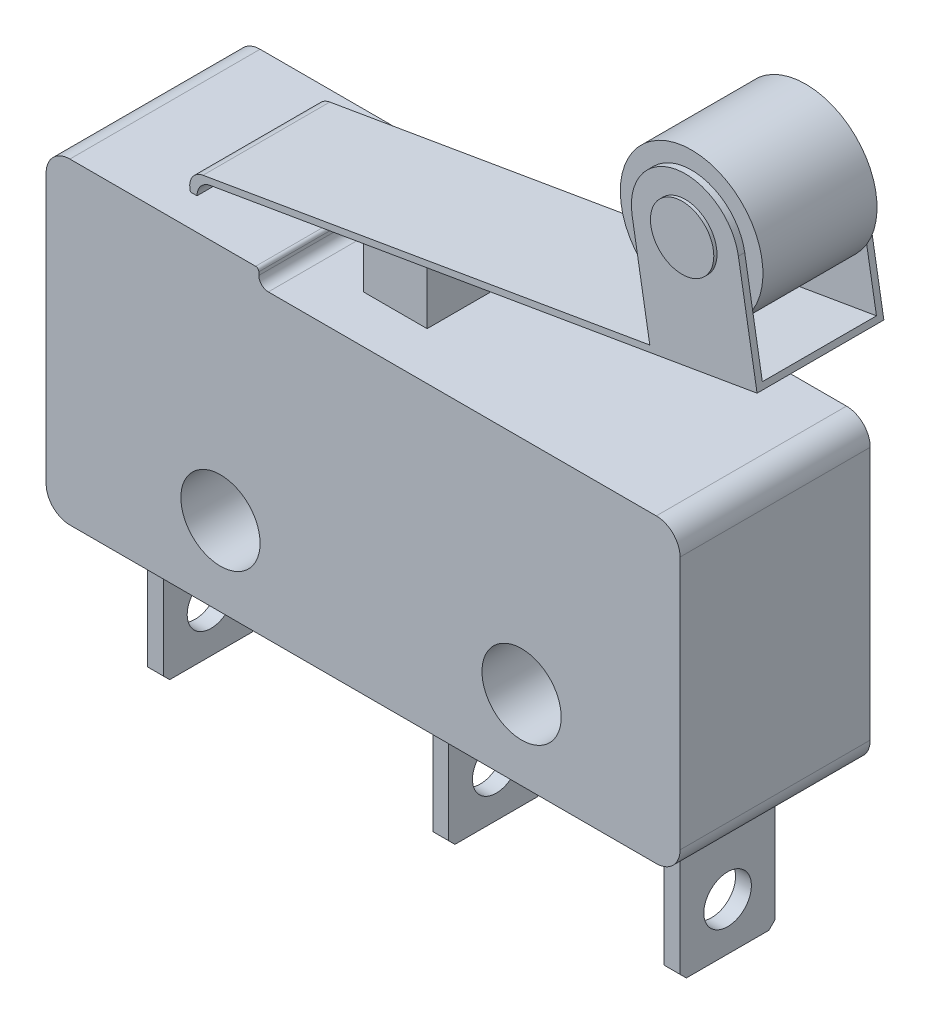
from build123d import *

# Parameters (mm, degrees)
CROQUIS1_R              = 1.25
SALIENTE_EXTRUIR3_DEPTH = 3
CROQUIS7_W              = 0.5
CROQUIS7_H              = 4.35
SALIENTE_EXTRUIR4_DEPTH = 1.5
CROQUIS8_R              = 0.75
CORTAR_EXTRUIR1_DEPTH   = 21.944510021
SALIENTE_EXTRUIR5_DEPTH = 1.5
CROQUIS10_R             = 0.5
SALIENTE_EXTRUIR6_DEPTH = 2
CORTAR_EXTRUIR2_REACH   = 27.447
CROQUIS11_W             = 3.6
CROQUIS11_H             = 5.5
CROQUIS12_R             = 2.25
SALIENTE_EXTRUIR8_DEPTH = 3.6
CROQUIS13_R             = 1
SALIENTE_EXTRUIR9_DEPTH = 2.1


with BuildPart() as part:
    # Croquis1 → Saliente-Extruir3 (new, symmetric)
    with BuildSketch(Plane.XY):
        with BuildLine():
            Line((-9.25, 5), (-3.39, 5))
            ThreePointArc((-3.39, 5), (-3.319289322, 4.970710678), (-3.29, 4.9))
            Line((-3.29, 4.9), (-3.29, 4.8))
            ThreePointArc((-3.29, 4.8), (-3.202132034, 4.587867966), (-2.99, 4.5))
            Line((-2.99, 4.5), (9.25, 4.5))
            ThreePointArc((9.25, 4.5), (9.780330086, 4.280330086), (10, 3.75))
            Line((10, 3.75), (10, -4.25))
            ThreePointArc((10, -4.25), (9.780330086, -4.780330086), (9.25, -5))
            Line((9.25, -5), (-9.25, -5))
            ThreePointArc((-9.25, -5), (-9.780330086, -4.780330086), (-10, -4.25))
            Line((-10, -4.25), (-10, 4.25))
            ThreePointArc((-10, 4.25), (-9.780330086, 4.780330086), (-9.25, 5))
        make_face()
        with Locations((-4.5, -2.5)):
            Circle(CROQUIS1_R, mode=Mode.SUBTRACT)
        with Locations((5, -2.5)):
            Circle(CROQUIS1_R, mode=Mode.SUBTRACT)
    extrude(amount=SALIENTE_EXTRUIR3_DEPTH, both=True)

    # Croquis7 → Saliente-Extruir4 (add, symmetric)
    with BuildSketch(Plane.XY):
        with Locations((-8.05, -7.175)):
            Rectangle(CROQUIS7_W, CROQUIS7_H)
        with Locations((0.95, -7.175)):
            Rectangle(CROQUIS7_W, CROQUIS7_H)
        with Locations((8.25, -7.175)):
            Rectangle(CROQUIS7_W, CROQUIS7_H)
    extrude(amount=SALIENTE_EXTRUIR4_DEPTH, both=True)

    # Croquis8 → Cortar-Extruir1 (cut, through all)
    with BuildSketch(Plane(origin=(8.5, 0, 0), x_dir=(0, 0, -1), z_dir=(1, 0, 0))):
        with Locations((0, -7.85)):
            Circle(CROQUIS8_R)
        Polygon((-1.5, -9.152010101), (-1.5, -9.35), (-1.302010101, -9.35), align=None)
        Polygon((1.302010101, -9.35), (1.5, -9.152010101), (1.5, -9.35), align=None)
    extrude(amount=-CORTAR_EXTRUIR1_DEPTH, mode=Mode.SUBTRACT)

    # Croquis9 → Saliente-Extruir5 (add, symmetric)
    with BuildSketch(Plane.XY):
        with BuildLine():
            Line((-1.48, 4.5), (0.52, 4.5))
            Line((0.52, 4.5), (0.52, 6.15))
            ThreePointArc((0.52, 6.15), (0.490710678, 6.220710678), (0.42, 6.25))
            Line((0.42, 6.25), (-1.38, 6.25))
            ThreePointArc((-1.38, 6.25), (-1.450710678, 6.220710678), (-1.48, 6.15))
            Line((-1.48, 6.15), (-1.48, 4.5))
        make_face()
    extrude(amount=SALIENTE_EXTRUIR5_DEPTH, both=True)

    # Croquis10 → Saliente-Extruir6 (add, symmetric)
    with BuildSketch(Plane.XY):
        with BuildLine():
            Line((-6.45, 5), (-6.24, 5))
            ThreePointArc((-6.24, 5), (-6.120788655, 5.324037035), (-5.82, 5.493558507))
            Line((-5.82, 5.493558507), (11.429810709, 8.44212265))
            Line((11.429810709, 8.44212265), (10.840097881, 11.892084791))
            ThreePointArc((10.840097881, 11.892084791), (8.877970038, 13.281348744), (7.488706086, 11.319220901))
            Line((7.488706086, 11.319220901), (8.044721038, 8.066399453))
            Line((8.044721038, 8.066399453), (-6.05083857, 5.657001325))
            ThreePointArc((-6.05083857, 5.657001325), (-6.380057775, 5.449678442), (-6.460998376, 5.06913057))
            Line((-6.460998376, 5.06913057), (-6.45, 5))
        make_face()
        with Locations((9.164401983, 11.605652846)):
            Circle(CROQUIS10_R, mode=Mode.SUBTRACT)
    extrude(amount=SALIENTE_EXTRUIR6_DEPTH, both=True)

    # Croquis11 → Cortar-Extruir2 (cut, up to next)
    with BuildSketch(Plane(origin=(12.50740608, 2.137930074, 0), x_dir=(0, 0, -1), z_dir=(0.9857034690888546, 0.16848937956499643, 0)), mode=Mode.PRIVATE) as cortar_extruir2_sk1:
        with Locations((0, 9.345627867)):
            Rectangle(CROQUIS11_W, CROQUIS11_H)
    cortar_extruir2_tool1 = extrude(cortar_extruir2_sk1.sketch, amount=-CORTAR_EXTRUIR2_REACH, mode=Mode.PRIVATE) & part.part
    add(cortar_extruir2_tool1.solids().sort_by_distance((10.932767, 11.349948, 0))[0], mode=Mode.SUBTRACT)

    # Croquis12 → Saliente-Extruir8 (add)
    with BuildSketch(Plane(origin=(0, 0, 1.8), x_dir=(-1, 0, 0), z_dir=(0, 0, -1))):
        with Locations(Location((-9.164401983, 11.605652846, 0), (0, 0, 211.22606331))):
            Circle(CROQUIS12_R)
    extrude(amount=SALIENTE_EXTRUIR8_DEPTH)

    # Croquis13 → Saliente-Extruir9 (add, symmetric)
    with BuildSketch(Plane.XY):
        with Locations((9.164401983, 11.605652846)):
            Circle(CROQUIS13_R)
    extrude(amount=SALIENTE_EXTRUIR9_DEPTH, both=True)


solid = part.part
